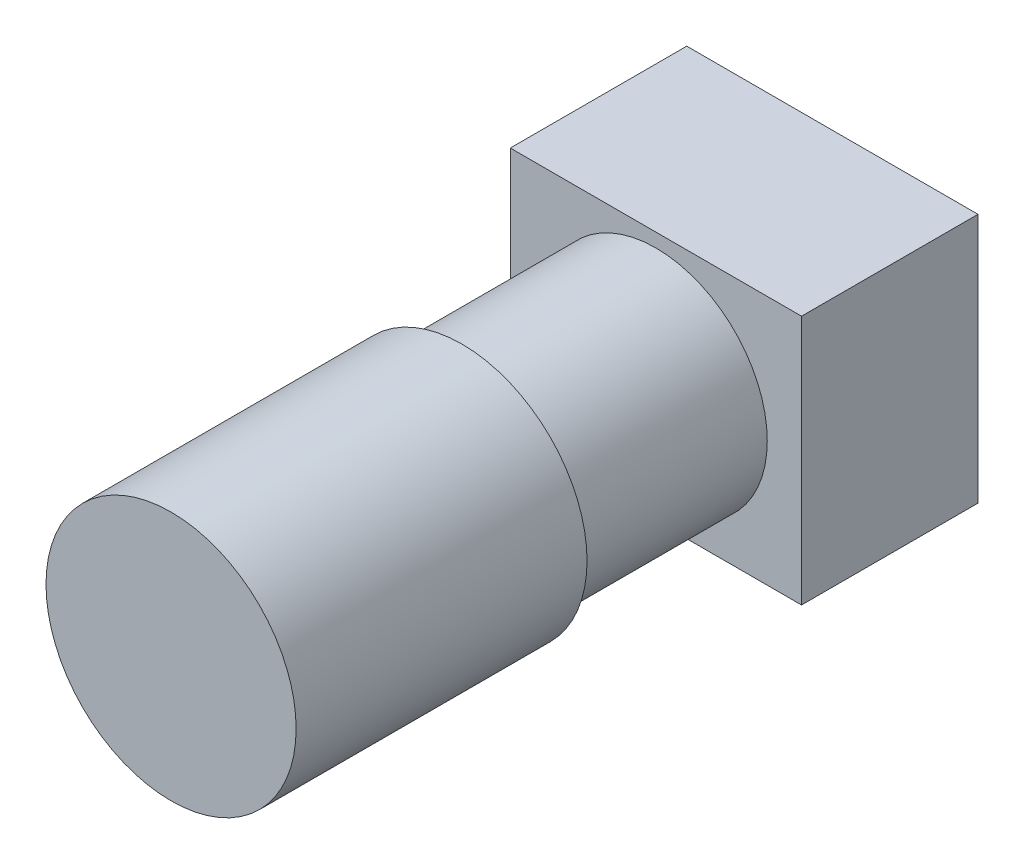
from build123d import *

# Parameters (mm, degrees)
SKETCH1_W           = 170
SKETCH1_H           = 146
BOSS_EXTRUDE1_DEPTH = 103
SKETCH2_R           = 65
BOSS_EXTRUDE2_DEPTH = 113.2
SKETCH3_R           = 73
BOSS_EXTRUDE3_DEPTH = 169.8


with BuildPart() as part:
    # Sketch1 → Boss-Extrude1 (new body)
    with BuildSketch(Plane.XY):
        Rectangle(SKETCH1_W, SKETCH1_H)
    extrude(amount=BOSS_EXTRUDE1_DEPTH)

    # Sketch2 → Boss-Extrude2 (add)
    with BuildSketch(Plane.XY.offset(103)):
        Circle(SKETCH2_R)
    extrude(amount=BOSS_EXTRUDE2_DEPTH)

    # Sketch3 → Boss-Extrude3 (add)
    with BuildSketch(Plane.XY.offset(216.2)):
        Circle(SKETCH3_R)
    extrude(amount=BOSS_EXTRUDE3_DEPTH)


solid = part.part
